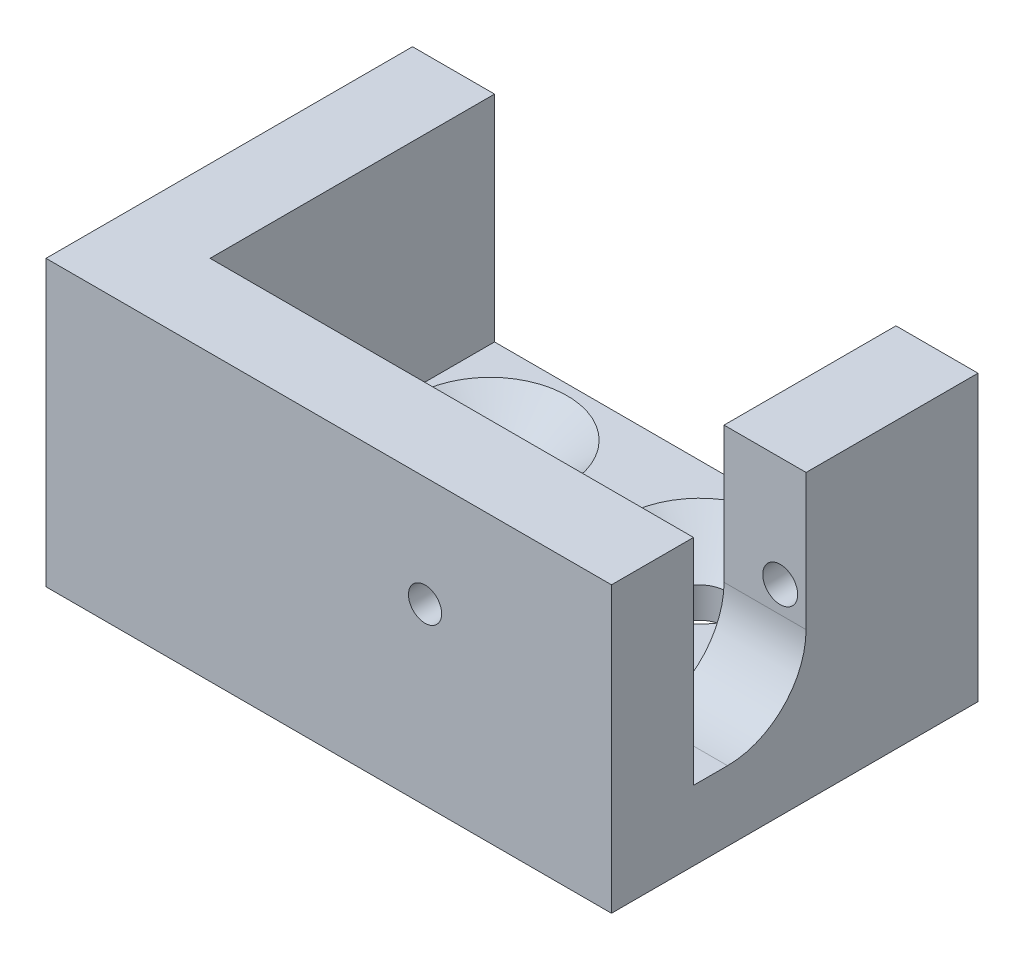
from build123d import *

# Parameters (mm, degrees)
ESQUISSE1_W             = 32.4
ESQUISSE1_H             = 21
BOSS_EXTRU_1_DEPTH      = 4
ESQUISSE2_W             = 4.7
ESQUISSE2_H             = 9.85
BOSS_EXTRU_2_DEPTH      = 12.3
ENL_V_MAT_EXTRU_1_REACH = 33.528
ESQUISSE3_R             = 0.95
CHANFREIN1_SIZE         = 1.915
CHANFREIN1_SIZE2        = 1.6
ESQUISSE4_R             = 1
ENL_V_MAT_EXTRU_2_DEPTH = 10
CONG_1_R                = 4.5
ESQUISSE5_R             = 1.5
ENL_V_MAT_EXTRU_3_DEPTH = 30.657924742
CHANFREIN2_SIZE         = 2.915
CHANFREIN2_SIZE2        = 2.24


with BuildPart() as part:
    # Esquisse1 → Boss.-Extru.1 (new body)
    with BuildSketch(Plane(origin=(0, 0, 0), x_dir=(1, 0, 0), z_dir=(0, 1, 0))):
        with Locations((0.75, -10.5)):
            Rectangle(ESQUISSE1_W, ESQUISSE1_H)
    extrude(amount=BOSS_EXTRU_1_DEPTH)

    # Esquisse2 → Boss.-Extru.2 (add)
    with BuildSketch(Plane(origin=(0, 4, 0), x_dir=(1, 0, 0), z_dir=(0, 1, 0))):
        Polygon((-15.45, 0), (-10.75, 0), (-10.75, -16.3), (16.95, -16.3), (16.95, -21), (-15.45, -21), align=None)
        with Locations((14.6, -4.925)):
            Rectangle(ESQUISSE2_W, ESQUISSE2_H)
    extrude(amount=BOSS_EXTRU_2_DEPTH)

    # Esquisse3 → Enlèv. mat.-Extru.1 (cut, up to next)
    with BuildSketch(Plane.XY.offset(21), mode=Mode.PRIVATE) as enl_v_mat_extru_1_sk1:
        with Locations((6.268372061, 10)):
            Circle(ESQUISSE3_R)
    enl_v_mat_extru_1_tool1 = extrude(enl_v_mat_extru_1_sk1.sketch, amount=-ENL_V_MAT_EXTRU_1_REACH, mode=Mode.PRIVATE) & part.part
    add(enl_v_mat_extru_1_tool1.solids().sort_by_distance((6.268372, 10, 21))[0], mode=Mode.SUBTRACT)

    # Chanfrein1
    chanfrein1_edges = [part.edges().sort_by_distance(p)[0] for p in [
        (5.318372061, 10, 16.3),
    ]]
    chanfrein1_side = [part.faces().sort_by_distance(p)[0] for p in [
        (3.073412496, 10.15125873, 16.3),
    ]]
    chamfer(chanfrein1_edges, length=CHANFREIN1_SIZE, length2=CHANFREIN1_SIZE2, reference=chanfrein1_side[0])

    # Esquisse4 → Enlèv. mat.-Extru.2 (cut)
    with BuildSketch(Plane(origin=(0, 0, 0), x_dir=(-1, 0, 0), z_dir=(0, 0, -1))):
        with Locations((-15.468268339, 10)):
            Circle(ESQUISSE4_R)
        with Locations((13.27835463, 10)):
            Circle(ESQUISSE4_R)
    extrude(amount=-ENL_V_MAT_EXTRU_2_DEPTH, mode=Mode.SUBTRACT)

    # Congé1
    cong_1_edges = [part.edges().sort_by_distance(p)[0] for p in [
        (14.6, 4, 9.85),
    ]]
    fillet(cong_1_edges, radius=CONG_1_R)

    # Esquisse5 → Enlèv. mat.-Extru.3 (cut, through all)
    with BuildSketch(Plane(origin=(0, 4, 0), x_dir=(1, 0, 0), z_dir=(0, 1, 0))):
        with Locations(Location((-6, -5, 0), (0, 0, 270))):
            Circle(ESQUISSE5_R)
        with Locations(Location((6, -5, 0), (0, 0, 270))):
            Circle(ESQUISSE5_R)
    extrude(amount=-ENL_V_MAT_EXTRU_3_DEPTH, mode=Mode.SUBTRACT)

    # Chanfrein2
    chanfrein2_edges = [part.edges().sort_by_distance(p)[0] for p in [
        (-6, 4, 3.5),
        (6, 4, 3.5),
    ]]
    chanfrein2_side = [part.faces().sort_by_distance(p)[0] for p in [
        (1.12179718, 4, 8.448141802),
    ]]
    chamfer(chanfrein2_edges, length=CHANFREIN2_SIZE, length2=CHANFREIN2_SIZE2, reference=chanfrein2_side[0])


solid = part.part
